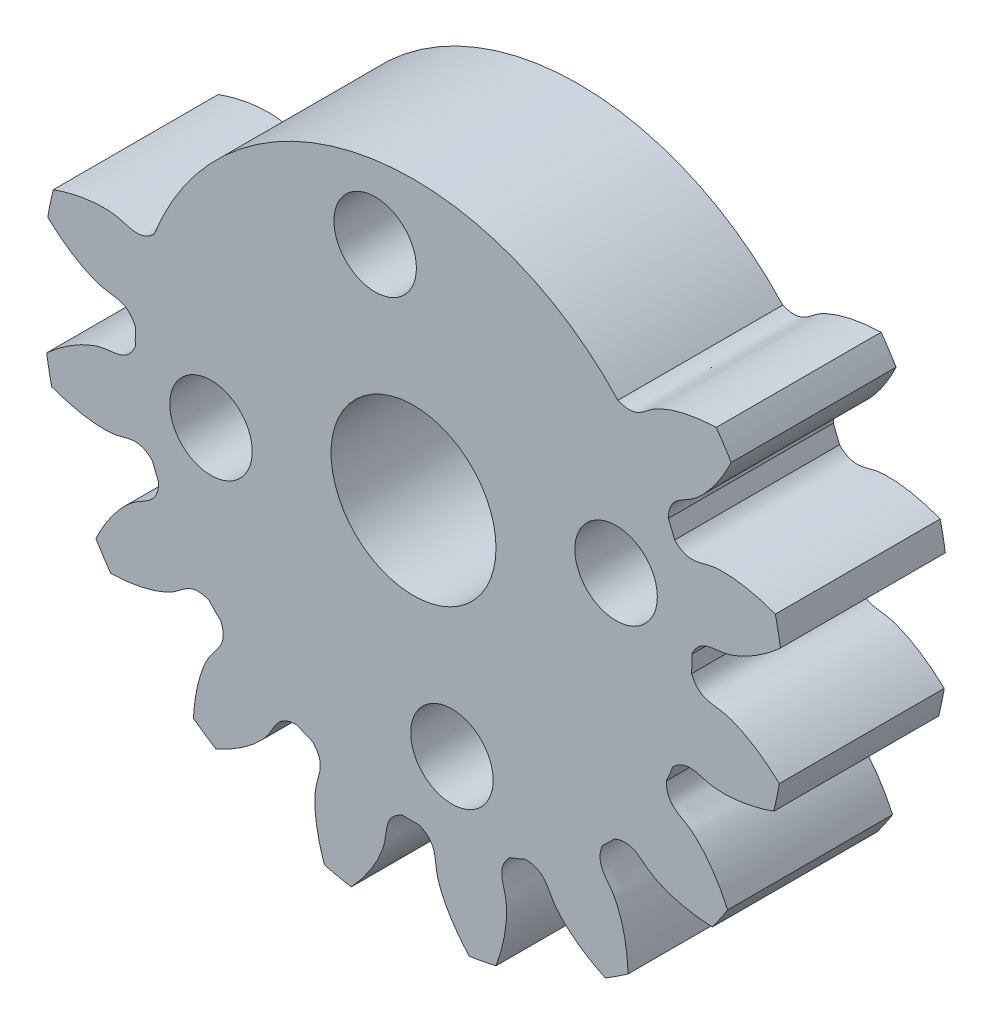
from build123d import *

# Parameters (mm, degrees)
SKETCH_1_R      = 2
SKETCH_1_R_2    = 1
EXTRUDE_1_DEPTH = 4


with BuildPart() as part:
    # 草图1 → 凸台-拉伸1 (new body)
    with BuildSketch(Plane.XY):
        with BuildLine():
            ThreePointArc((0.996150024, -57.734447411), (0.922879064, -57.544720328), (0.843925358, -57.357286842))
            add(Edge.make_bspline(
                [(0.843925358, -57.357286842), (0.849686785, -56.882115821), (1.192652395, -56.821894577), (1.465306628, -56.628090496), (1.503240581, -56.599303482), (1.554320256, -56.557243837), (1.612666103, -56.505179701), (1.677544532, -56.442474343), (1.748184225, -56.368535726), (1.823777215, -56.282816612), (1.903481608, -56.184817015), (1.986424012, -56.074085906), (2.071702143, -55.950222938), (2.158387505, -55.812880007), (2.245528133, -55.661762681), (2.315203877, -55.528938767), (2.355517948, -55.446433451), (2.368307185, -55.419651352)],
                knots=[0, 0, 0, 0, 0.200958108, 0.205848205, 0.217584439, 0.231928724, 0.248881062, 0.268441451, 0.290609892, 0.315386384, 0.342770929, 0.372763526, 0.405364174, 0.440572874, 0.478389626, 0.51881443, 0.538120392, 0.538120392, 0.538120392, 0.538120392], degree=3))
            ThreePointArc((2.368307185, -55.419651352), (2.191830509, -55.139132944), (2.005145517, -54.865302142))
            add(Edge.make_bspline(
                [(-0.380078577, -55.488902391), (0.05784628, -55.673408524), (0.250039344, -55.383040079), (0.536614403, -55.210485484), (0.578156743, -55.187206503), (0.637117598, -55.157177108), (0.708152476, -55.124482181), (0.79155211, -55.090048573), (0.887551194, -55.054819872), (0.996328709, -55.019755374), (1.118006767, -54.985826603), (1.252650017, -54.954014406), (1.400265106, -54.925305873), (1.560800316, -54.900691263), (1.73414535, -54.881160908), (1.883743837, -54.870335305), (1.975484278, -54.866329924), (2.005145517, -54.865302142)],
                knots=[0, 0, 0, 0, 0.200958108, 0.205848205, 0.217584439, 0.231928724, 0.248881062, 0.268441451, 0.290609892, 0.315386384, 0.342770929, 0.372763526, 0.405364174, 0.440572874, 0.478389626, 0.51881443, 0.538120392, 0.538120392, 0.538120392, 0.538120392], degree=3))
            ThreePointArc((-0.380078577, -55.488902391), (-6.59317, -53.439065585), (-11.625686466, -57.61974902))
            add(Edge.make_bspline(
                [(-11.625686466, -57.61974902), (-11.965757062, -57.951671727), (-12.25085322, -57.751741269), (-12.580689057, -57.695985791), (-12.627867905, -57.689517928), (-12.69372735, -57.683139805), (-12.771798998, -57.678697964), (-12.862014358, -57.677161371), (-12.964246662, -57.679494062), (-13.078311545, -57.686654313), (-13.203967242, -57.699590976), (-13.340915095, -57.719240558), (-13.488800185, -57.746524157), (-13.64721211, -57.782344468), (-13.815685925, -57.827582825), (-13.958874806, -57.872235324), (-14.045721228, -57.90206904), (-14.073702387, -57.911963488)],
                knots=[0, 0, 0, 0, 0.200958108, 0.205848205, 0.217584439, 0.231928724, 0.248881062, 0.268441451, 0.290609892, 0.315386384, 0.342770929, 0.372763526, 0.405364174, 0.440572874, 0.478389626, 0.51881443, 0.538120392, 0.538120392, 0.538120392, 0.538120392], degree=3))
            ThreePointArc((-14.073702387, -57.911963488), (-14.147271002, -58.23510781), (-14.208892395, -58.560741651))
            add(Edge.make_bspline(
                [(-12.081332299, -59.806397818), (-12.260526397, -59.366272644), (-12.601748912, -59.435693121), (-12.926402604, -59.355068478), (-12.9722382, -59.342154333), (-13.035163808, -59.321696701), (-13.108511857, -59.294586262), (-13.191832542, -59.259962053), (-13.284624598, -59.216990903), (-13.386336261, -59.164867929), (-13.496366905, -59.102819814), (-13.61406868, -59.030107278), (-13.738748309, -58.946027646), (-13.869669003, -58.849917268), (-14.006052498, -58.741153866), (-14.11948946, -58.643026618), (-14.187191981, -58.580988562), (-14.208892395, -58.560741651)],
                knots=[0, 0, 0, 0, 0.200958108, 0.205848205, 0.217584439, 0.231928724, 0.248881062, 0.268441451, 0.290609892, 0.315386384, 0.342770929, 0.372763526, 0.405364174, 0.440572874, 0.478389626, 0.51881443, 0.538120392, 0.538120392, 0.538120392, 0.538120392], degree=3))
            ThreePointArc((-12.081332299, -59.806397818), (-12.08624417, -60.009722369), (-12.085028147, -60.213102606))
            add(Edge.make_bspline(
                [(-12.085028147, -60.213102606), (-12.272191089, -60.649898584), (-12.612095668, -60.574288502), (-12.938160945, -60.648999868), (-12.984223661, -60.661078905), (-13.047510656, -60.680389605), (-13.121339272, -60.706162606), (-13.205275426, -60.739266903), (-13.298833077, -60.780544637), (-13.401475178, -60.830810588), (-13.512615258, -60.890848859), (-13.631619007, -60.96141038), (-13.757806033, -61.043210313), (-13.890451729, -61.136925585), (-14.028789269, -61.243192514), (-14.143990774, -61.339242056), (-14.212809537, -61.400039502), (-14.234874316, -61.419888707)],
                knots=[0, 0, 0, 0, 0.200958108, 0.205848205, 0.217584439, 0.231928724, 0.248881062, 0.268441451, 0.290609892, 0.315386384, 0.342770929, 0.372763526, 0.405364174, 0.440572874, 0.478389626, 0.51881443, 0.538120392, 0.538120392, 0.538120392, 0.538120392], degree=3))
            ThreePointArc((-14.234874316, -61.419888707), (-14.179180875, -61.746588622), (-14.111496942, -62.071016549))
            add(Edge.make_bspline(
                [(-11.669195739, -62.407670786), (-12.00317811, -62.069622759), (-12.291860542, -62.26433912), (-12.622655158, -62.314091252), (-12.669943756, -62.31970066), (-12.735908234, -62.324880861), (-12.814047711, -62.327903165), (-12.904276098, -62.327800012), (-13.006449127, -62.323609828), (-13.120365048, -62.314377848), (-13.245764894, -62.299159768), (-13.382333038, -62.277024665), (-13.529697878, -62.247058042), (-13.687432676, -62.208364811), (-13.855056548, -62.160072234), (-13.997410308, -62.112824924), (-14.083700216, -62.081417867), (-14.111496942, -62.071016549)],
                knots=[0, 0, 0, 0, 0.200958108, 0.205848205, 0.217584439, 0.231928724, 0.248881062, 0.268441451, 0.290609892, 0.315386384, 0.342770929, 0.372763526, 0.405364174, 0.440572874, 0.478389626, 0.51881443, 0.538120392, 0.538120392, 0.538120392, 0.538120392], degree=3))
            ThreePointArc((-11.669195739, -62.407670786), (-11.595924779, -62.597397869), (-11.516971072, -62.784831355))
            add(Edge.make_bspline(
                [(-11.516971072, -62.784831355), (-11.5227325, -63.260002376), (-11.865698109, -63.32022362), (-12.138352343, -63.514027701), (-12.176286296, -63.542814715), (-12.22736597, -63.58487436), (-12.285711817, -63.636938496), (-12.350590246, -63.699643854), (-12.42122994, -63.773582471), (-12.49682293, -63.859301585), (-12.576527323, -63.957301182), (-12.659469726, -64.068032291), (-12.744747858, -64.191895259), (-12.831433219, -64.32923819), (-12.918573848, -64.480355516), (-12.988249591, -64.613179429), (-13.028563663, -64.695684746), (-13.041352899, -64.722466845)],
                knots=[0, 0, 0, 0, 0.200958108, 0.205848205, 0.217584439, 0.231928724, 0.248881062, 0.268441451, 0.290609892, 0.315386384, 0.342770929, 0.372763526, 0.405364174, 0.440572874, 0.478389626, 0.51881443, 0.538120392, 0.538120392, 0.538120392, 0.538120392], degree=3))
            ThreePointArc((-13.041352899, -64.722466845), (-12.864876223, -65.002985253), (-12.678191231, -65.276816055))
            add(Edge.make_bspline(
                [(-10.292967138, -64.653215806), (-10.730891994, -64.468709673), (-10.923085059, -64.759078118), (-11.209660118, -64.931632713), (-11.251202458, -64.954911694), (-11.310163312, -64.984941088), (-11.38119819, -65.017636016), (-11.464597825, -65.052069624), (-11.560596908, -65.087298324), (-11.669374423, -65.122362823), (-11.791052481, -65.156291594), (-11.925695731, -65.188103791), (-12.073310821, -65.216812324), (-12.233846031, -65.241426933), (-12.407191064, -65.260957289), (-12.556789552, -65.271782892), (-12.648529993, -65.275788273), (-12.678191231, -65.276816055)],
                knots=[0, 0, 0, 0, 0.200958108, 0.205848205, 0.217584439, 0.231928724, 0.248881062, 0.268441451, 0.290609892, 0.315386384, 0.342770929, 0.372763526, 0.405364174, 0.440572874, 0.478389626, 0.51881443, 0.538120392, 0.538120392, 0.538120392, 0.538120392], degree=3))
            ThreePointArc((-10.292967138, -64.653215806), (-10.152668186, -64.800461193), (-10.007996783, -64.943412879))
            add(Edge.make_bspline(
                [(-10.007996783, -64.943412879), (-9.83147957, -65.384618462), (-10.125292805, -65.571502893), (-10.30302686, -65.854894775), (-10.327056949, -65.896007203), (-10.358152886, -65.954412594), (-10.392133338, -66.024841573), (-10.428076889, -66.107601669), (-10.465044372, -66.202944684), (-10.502079904, -66.311067005), (-10.538214339, -66.432108377), (-10.572468167, -66.566151266), (-10.603854581, -66.713220255), (-10.631382548, -66.87328163), (-10.654059894, -67.046243109), (-10.667602377, -67.195620157), (-10.673274304, -67.287272657), (-10.674840953, -67.316910319)],
                knots=[0, 0, 0, 0, 0.200958108, 0.205848205, 0.217584439, 0.231928724, 0.248881062, 0.268441451, 0.290609892, 0.315386384, 0.342770929, 0.372763526, 0.405364174, 0.440572874, 0.478389626, 0.51881443, 0.538120392, 0.538120392, 0.538120392, 0.538120392], degree=3))
            ThreePointArc((-10.674840953, -67.316910319), (-10.404448017, -67.508540835), (-10.127183062, -67.690086254))
            add(Edge.make_bspline(
                [(-8.162164825, -66.201169005), (-8.637362078, -66.198294153), (-8.703806123, -66.540108717), (-8.90253317, -66.809195903), (-8.932004807, -66.846600442), (-8.974985782, -66.896907327), (-9.028101645, -66.954297372), (-9.091975689, -67.018025537), (-9.167185837, -67.087309871), (-9.254264554, -67.161332596), (-9.353696443, -67.23924287), (-9.465916585, -67.320159248), (-9.591308865, -67.403172323), (-9.730204457, -67.487347423), (-9.882880442, -67.571727391), (-10.016948644, -67.638977807), (-10.100172966, -67.677785843), (-10.127183062, -67.690086254)],
                knots=[0, 0, 0, 0, 0.200958108, 0.205848205, 0.217584439, 0.231928724, 0.248881062, 0.268441451, 0.290609892, 0.315386384, 0.342770929, 0.372763526, 0.405364174, 0.440572874, 0.478389626, 0.51881443, 0.538120392, 0.538120392, 0.538120392, 0.538120392], degree=3))
            ThreePointArc((-8.162164825, -66.201169005), (-7.976197126, -66.28351592), (-7.787832936, -66.360222707))
            add(Edge.make_bspline(
                [(-7.787832936, -66.360222707), (-7.455910229, -66.700293303), (-7.655840687, -66.985389461), (-7.711596165, -67.315225298), (-7.718064027, -67.362404146), (-7.724442151, -67.428263591), (-7.728883992, -67.506335239), (-7.730420585, -67.5965506), (-7.728087894, -67.698782903), (-7.720927643, -67.812847786), (-7.70799098, -67.938503483), (-7.688341398, -68.075451336), (-7.661057799, -68.223336426), (-7.625237487, -68.381748351), (-7.57999913, -68.550222166), (-7.535346632, -68.693411047), (-7.505512916, -68.780257469), (-7.495618468, -68.808238629)],
                knots=[0, 0, 0, 0, 0.200958108, 0.205848205, 0.217584439, 0.231928724, 0.248881062, 0.268441451, 0.290609892, 0.315386384, 0.342770929, 0.372763526, 0.405364174, 0.440572874, 0.478389626, 0.51881443, 0.538120392, 0.538120392, 0.538120392, 0.538120392], degree=3))
            ThreePointArc((-7.495618468, -68.808238629), (-7.172474145, -68.881807243), (-6.846840305, -68.943428636))
            add(Edge.make_bspline(
                [(-5.601184138, -66.81586854), (-6.041309312, -66.995062638), (-5.971888835, -67.336285153), (-6.052513478, -67.660938846), (-6.065427623, -67.706774441), (-6.085885254, -67.76970005), (-6.112995693, -67.843048098), (-6.147619903, -67.926368783), (-6.190591053, -68.019160839), (-6.242714027, -68.120872502), (-6.304762142, -68.230903146), (-6.377474677, -68.348604922), (-6.46155431, -68.473284551), (-6.557664688, -68.604205244), (-6.66642809, -68.740588739), (-6.764555338, -68.854025702), (-6.826593393, -68.921728222), (-6.846840305, -68.943428636)],
                knots=[0, 0, 0, 0, 0.200958108, 0.205848205, 0.217584439, 0.231928724, 0.248881062, 0.268441451, 0.290609892, 0.315386384, 0.342770929, 0.372763526, 0.405364174, 0.440572874, 0.478389626, 0.51881443, 0.538120392, 0.538120392, 0.538120392, 0.538120392], degree=3))
            ThreePointArc((-5.601184138, -66.81586854), (-5.397859587, -66.820780412), (-5.19447935, -66.819564388))
            add(Edge.make_bspline(
                [(-5.19447935, -66.819564388), (-4.757683372, -67.00672733), (-4.833293454, -67.346631909), (-4.758582088, -67.672697186), (-4.74650305, -67.718759902), (-4.72719235, -67.782046897), (-4.70141935, -67.855875514), (-4.668315053, -67.939811668), (-4.627037318, -68.033369318), (-4.576771368, -68.13601142), (-4.516733097, -68.247151499), (-4.446171575, -68.366155249), (-4.364371643, -68.492342275), (-4.270656371, -68.62498797), (-4.164389441, -68.76332551), (-4.068339899, -68.878527015), (-4.007542453, -68.947345778), (-3.987693249, -68.969410557)],
                knots=[0, 0, 0, 0, 0.200958108, 0.205848205, 0.217584439, 0.231928724, 0.248881062, 0.268441451, 0.290609892, 0.315386384, 0.342770929, 0.372763526, 0.405364174, 0.440572874, 0.478389626, 0.51881443, 0.538120392, 0.538120392, 0.538120392, 0.538120392], degree=3))
            ThreePointArc((-3.987693249, -68.969410557), (-3.660993333, -68.913717116), (-3.336565407, -68.846033184))
            add(Edge.make_bspline(
                [(-2.99991117, -66.40373198), (-3.337959197, -66.737714351), (-3.143242836, -67.026396783), (-3.093490704, -67.357191399), (-3.087881295, -67.404479997), (-3.082701095, -67.470444476), (-3.079678791, -67.548583952), (-3.079781944, -67.638812339), (-3.083972127, -67.740985368), (-3.093204108, -67.85490129), (-3.108422187, -67.980301136), (-3.130557291, -68.116869279), (-3.160523914, -68.264234119), (-3.199217145, -68.421968917), (-3.247509722, -68.589592789), (-3.294757032, -68.731946549), (-3.326164089, -68.818236458), (-3.336565407, -68.846033184)],
                knots=[0, 0, 0, 0, 0.200958108, 0.205848205, 0.217584439, 0.231928724, 0.248881062, 0.268441451, 0.290609892, 0.315386384, 0.342770929, 0.372763526, 0.405364174, 0.440572874, 0.478389626, 0.51881443, 0.538120392, 0.538120392, 0.538120392, 0.538120392], degree=3))
            ThreePointArc((-2.99991117, -66.40373198), (-2.810184087, -66.33046102), (-2.622750601, -66.251507314))
            add(Edge.make_bspline(
                [(-2.622750601, -66.251507314), (-2.14757958, -66.257268741), (-2.087358336, -66.60023435), (-1.893554255, -66.872888584), (-1.864767241, -66.910822537), (-1.822707596, -66.961902211), (-1.77064346, -67.020248059), (-1.707938102, -67.085126487), (-1.633999485, -67.155766181), (-1.54828037, -67.231359171), (-1.450280773, -67.311063564), (-1.339549665, -67.394005967), (-1.215686697, -67.479284099), (-1.078343766, -67.56596946), (-0.927226439, -67.653110089), (-0.794402526, -67.722785833), (-0.71189721, -67.763099904), (-0.685115111, -67.77588914)],
                knots=[0, 0, 0, 0, 0.200958108, 0.205848205, 0.217584439, 0.231928724, 0.248881062, 0.268441451, 0.290609892, 0.315386384, 0.342770929, 0.372763526, 0.405364174, 0.440572874, 0.478389626, 0.51881443, 0.538120392, 0.538120392, 0.538120392, 0.538120392], degree=3))
            ThreePointArc((-0.685115111, -67.77588914), (-0.404596703, -67.599412465), (-0.130765901, -67.412727472))
            add(Edge.make_bspline(
                [(-0.75436615, -65.027503379), (-0.938872282, -65.465428236), (-0.648503838, -65.6576213), (-0.475949243, -65.944196359), (-0.452670262, -65.985738699), (-0.422640867, -66.044699554), (-0.38994594, -66.115734431), (-0.355512332, -66.199134066), (-0.320283631, -66.29513315), (-0.285219133, -66.403910664), (-0.251290362, -66.525588722), (-0.219478165, -66.660231972), (-0.190769632, -66.807847062), (-0.166155022, -66.968382272), (-0.146624667, -67.141727305), (-0.135799064, -67.291325793), (-0.131793683, -67.383066234), (-0.130765901, -67.412727472)],
                knots=[0, 0, 0, 0, 0.200958108, 0.205848205, 0.217584439, 0.231928724, 0.248881062, 0.268441451, 0.290609892, 0.315386384, 0.342770929, 0.372763526, 0.405364174, 0.440572874, 0.478389626, 0.51881443, 0.538120392, 0.538120392, 0.538120392, 0.538120392], degree=3))
            ThreePointArc((-0.75436615, -65.027503379), (-0.607120763, -64.887204428), (-0.464169077, -64.742533024))
            add(Edge.make_bspline(
                [(-0.464169077, -64.742533024), (-0.022963493, -64.566015812), (0.163920938, -64.859829046), (0.44731282, -65.037563101), (0.488425248, -65.061593191), (0.546830638, -65.092689127), (0.617259617, -65.126669579), (0.700019713, -65.16261313), (0.795362729, -65.199580613), (0.903485049, -65.236616145), (1.024526422, -65.27275058), (1.15856931, -65.307004408), (1.305638299, -65.338390823), (1.465699674, -65.365918789), (1.638661153, -65.388596135), (1.788038201, -65.402138618), (1.879690701, -65.407810546), (1.909328363, -65.409377194)],
                knots=[0, 0, 0, 0, 0.200958108, 0.205848205, 0.217584439, 0.231928724, 0.248881062, 0.268441451, 0.290609892, 0.315386384, 0.342770929, 0.372763526, 0.405364174, 0.440572874, 0.478389626, 0.51881443, 0.538120392, 0.538120392, 0.538120392, 0.538120392], degree=3))
            ThreePointArc((1.909328363, -65.409377194), (2.100958879, -65.138984258), (2.282504298, -64.861719304))
            add(Edge.make_bspline(
                [(0.793587049, -62.896701067), (0.790712197, -63.371898319), (1.132526761, -63.438342364), (1.401613947, -63.637069411), (1.439018486, -63.666541048), (1.489325372, -63.709522023), (1.546715417, -63.762637886), (1.610443581, -63.82651193), (1.679727915, -63.901722079), (1.75375064, -63.988800796), (1.831660914, -64.088232684), (1.912577293, -64.200452827), (1.995590368, -64.325845106), (2.079765467, -64.464740698), (2.164145435, -64.617416683), (2.231395851, -64.751484885), (2.270203888, -64.834709207), (2.282504298, -64.861719304)],
                knots=[0, 0, 0, 0, 0.200958108, 0.205848205, 0.217584439, 0.231928724, 0.248881062, 0.268441451, 0.290609892, 0.315386384, 0.342770929, 0.372763526, 0.405364174, 0.440572874, 0.478389626, 0.51881443, 0.538120392, 0.538120392, 0.538120392, 0.538120392], degree=3))
            ThreePointArc((0.793587049, -62.896701067), (0.875933964, -62.710733367), (0.952640752, -62.522369177))
            add(Edge.make_bspline(
                [(0.952640752, -62.522369177), (1.292711347, -62.19044647), (1.577807505, -62.390376928), (1.907643343, -62.446132406), (1.954822191, -62.452600268), (2.020681635, -62.458978392), (2.098753283, -62.463420233), (2.188968644, -62.464956826), (2.291200948, -62.462624135), (2.405265831, -62.455463884), (2.530921527, -62.442527221), (2.667869381, -62.422877639), (2.81575447, -62.39559404), (2.974166395, -62.359773728), (3.142640211, -62.314535372), (3.285829091, -62.269882873), (3.372675513, -62.240049157), (3.400656673, -62.230154709)],
                knots=[0, 0, 0, 0, 0.200958108, 0.205848205, 0.217584439, 0.231928724, 0.248881062, 0.268441451, 0.290609892, 0.315386384, 0.342770929, 0.372763526, 0.405364174, 0.440572874, 0.478389626, 0.51881443, 0.538120392, 0.538120392, 0.538120392, 0.538120392], degree=3))
            ThreePointArc((3.400656673, -62.230154709), (3.474225287, -61.907010387), (3.53584668, -61.581376546))
            add(Edge.make_bspline(
                [(1.408286585, -60.335720379), (1.587480683, -60.775845553), (1.928703198, -60.706425076), (2.25335689, -60.787049719), (2.299192485, -60.799963864), (2.362118094, -60.820421496), (2.435466143, -60.847531934), (2.518786828, -60.882156144), (2.611578884, -60.925127294), (2.713290546, -60.977250268), (2.823321191, -61.039298383), (2.941022966, -61.112010919), (3.065702595, -61.196090551), (3.196623288, -61.292200929), (3.333006784, -61.400964331), (3.446443746, -61.499091579), (3.514146266, -61.561129634), (3.53584668, -61.581376546)],
                knots=[0, 0, 0, 0, 0.200958108, 0.205848205, 0.217584439, 0.231928724, 0.248881062, 0.268441451, 0.290609892, 0.315386384, 0.342770929, 0.372763526, 0.405364174, 0.440572874, 0.478389626, 0.51881443, 0.538120392, 0.538120392, 0.538120392, 0.538120392], degree=3))
            ThreePointArc((1.408286585, -60.335720379), (1.413198456, -60.132395828), (1.411982432, -59.929015591))
            add(Edge.make_bspline(
                [(1.411982432, -59.929015591), (1.599145374, -59.492219613), (1.939049953, -59.567829695), (2.26511523, -59.493118329), (2.311177946, -59.481039292), (2.374464941, -59.461728592), (2.448293558, -59.435955591), (2.532229712, -59.402851294), (2.625787363, -59.36157356), (2.728429464, -59.311307609), (2.839569544, -59.251269338), (2.958573293, -59.180707817), (3.084760319, -59.098907884), (3.217406014, -59.005192612), (3.355743555, -58.898925683), (3.470945059, -58.802876141), (3.539763822, -58.742078694), (3.561828602, -58.72222949)],
                knots=[0, 0, 0, 0, 0.200958108, 0.205848205, 0.217584439, 0.231928724, 0.248881062, 0.268441451, 0.290609892, 0.315386384, 0.342770929, 0.372763526, 0.405364174, 0.440572874, 0.478389626, 0.51881443, 0.538120392, 0.538120392, 0.538120392, 0.538120392], degree=3))
            ThreePointArc((3.561828602, -58.72222949), (3.50613516, -58.395529575), (3.438451228, -58.071101648))
            add(Edge.make_bspline(
                [(0.996150024, -57.734447411), (1.330132396, -58.072495438), (1.618814827, -57.877779077), (1.949609444, -57.828026945), (1.996898041, -57.822417536), (2.06286252, -57.817237336), (2.141001997, -57.814215032), (2.231230384, -57.814318185), (2.333403412, -57.818508369), (2.447319334, -57.827740349), (2.57271918, -57.842958429), (2.709287324, -57.865093532), (2.856652163, -57.895060155), (3.014386962, -57.933753386), (3.182010834, -57.982045963), (3.324364593, -58.029293273), (3.410654502, -58.06070033), (3.438451228, -58.071101648)],
                knots=[0, 0, 0, 0, 0.200958108, 0.205848205, 0.217584439, 0.231928724, 0.248881062, 0.268441451, 0.290609892, 0.315386384, 0.342770929, 0.372763526, 0.405364174, 0.440572874, 0.478389626, 0.51881443, 0.538120392, 0.538120392, 0.538120392, 0.538120392], degree=3))
        make_face()
        with Locations((-5.336522857, -60.071059098)):
            Circle(SKETCH_1_R, mode=Mode.SUBTRACT)
        with Locations((-10.249110645, -61.001908834)):
            Circle(SKETCH_1_R_2, mode=Mode.SUBTRACT)
        with Locations((-4.405673122, -64.983646886)):
            Circle(SKETCH_1_R_2, mode=Mode.SUBTRACT)
        with Locations((-0.42393507, -59.140209363)):
            Circle(SKETCH_1_R_2, mode=Mode.SUBTRACT)
        with Locations((-6.267372593, -55.158471311)):
            Circle(SKETCH_1_R_2, mode=Mode.SUBTRACT)
    extrude(amount=EXTRUDE_1_DEPTH)


solid = part.part
